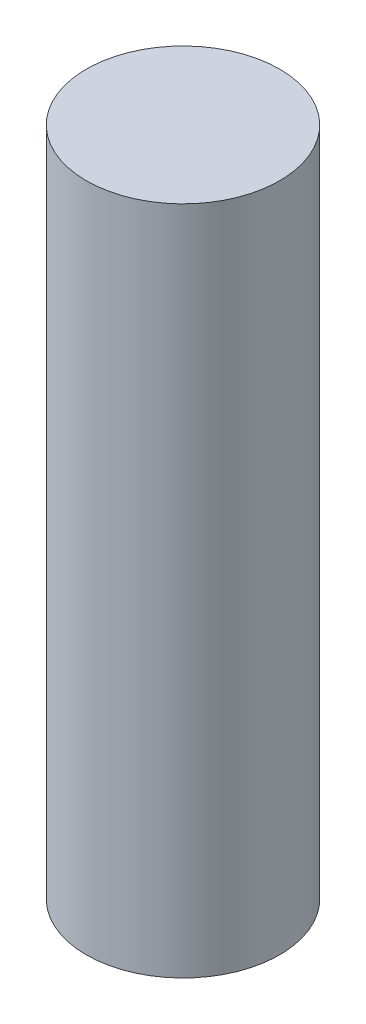
from build123d import *

# Parameters (mm, degrees)
SKETCH1_R           = 2.8575
BOSS_EXTRUDE1_DEPTH = 19.812


with BuildPart() as part:
    # Sketch1 → Boss-Extrude1 (new body)
    with BuildSketch(Plane(origin=(0, 0, 0), x_dir=(1, 0, 0), z_dir=(0, 1, 0))):
        with Locations(Location((0, 0, 0), (0, 0, 270))):
            Circle(SKETCH1_R)
    extrude(amount=BOSS_EXTRUDE1_DEPTH)


solid = part.part
